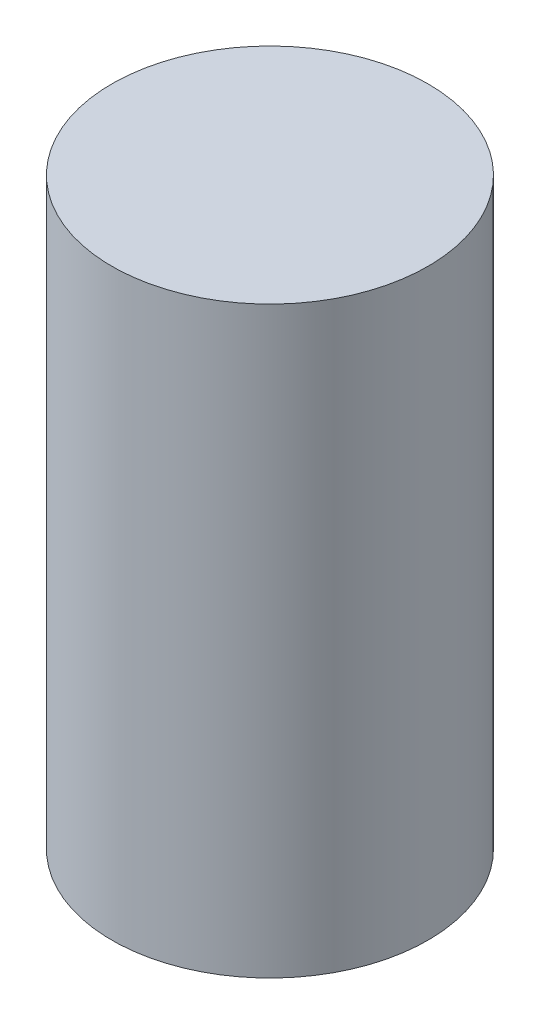
from build123d import *

# Parameters (mm, degrees)
SKETCH1_R           = 20.6375
BOSS_EXTRUDE1_DEPTH = 76.2
SKETCH2_R           = 3.175
CUT_EXTRUDE1_DEPTH  = 6.35


with BuildPart() as part:
    # Sketch1 → Boss-Extrude1 (new body)
    with BuildSketch(Plane(origin=(0, 0, 0), x_dir=(1, 0, 0), z_dir=(0, 1, 0))):
        with Locations(Location((0, 0, 0), (0, 0, 90))):
            Circle(SKETCH1_R)
    extrude(amount=BOSS_EXTRUDE1_DEPTH)

    # Sketch2 → Cut-Extrude1 (cut)
    with BuildSketch(Plane.XZ):
        with Locations(Location((-10.16, 0, 0), (0, 0, 270))):
            Circle(SKETCH2_R)
        with Locations(Location((10.16, 0, 0), (0, 0, 90))):
            Circle(SKETCH2_R)
    extrude(amount=-CUT_EXTRUDE1_DEPTH, mode=Mode.SUBTRACT)


solid = part.part
